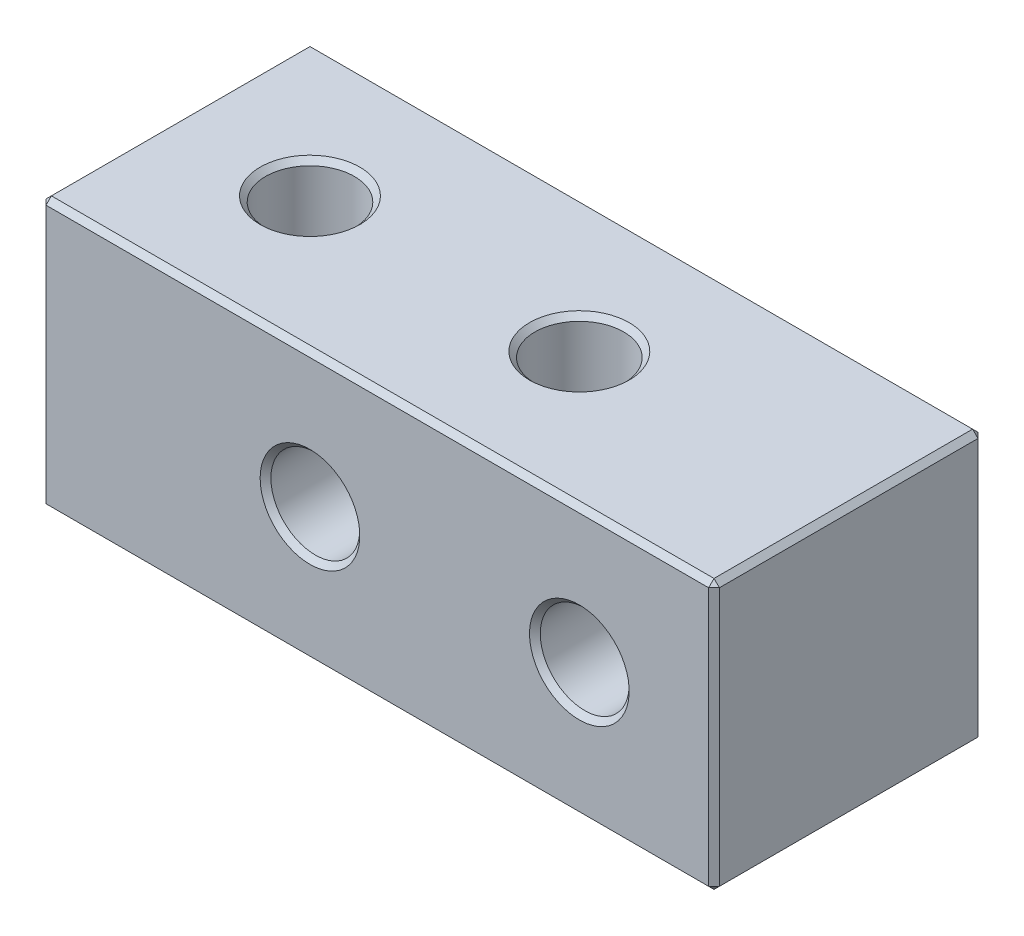
from build123d import *

# Parameters (mm, degrees)
SKETCH_1_W         = 25
SKETCH_1_H         = 10
EXTRUDE_1_DEPTH    = 5
HOLE_WIZARD_M4_1_D = 3.3
HOLE_WIZARD_M4_2_D = 3.3
CHAMFER_1_SIZE     = 0.2


with BuildPart() as part:
    # 草图1 → 凸台-拉伸1 (new, symmetric)
    with BuildSketch(Plane(origin=(0, 0, 0), x_dir=(1, 0, 0), z_dir=(0, 1, 0))):
        Rectangle(SKETCH_1_W, SKETCH_1_H)
    extrude(amount=EXTRUDE_1_DEPTH, both=True)

    # M4 螺纹孔1 (through all)
    with Locations(Plane(origin=(0, 5, 0), x_dir=(1, 0, 0), z_dir=(0, 1, 0))):
        with Locations((-7.5, 0), (2.5, 0)):
            Hole(HOLE_WIZARD_M4_1_D / 2)

    # M4 螺纹孔2 (through all)
    with Locations(Plane(origin=(0, 0, -5), x_dir=(-1, 0, 0), z_dir=(0, 0, -1))):
        with Locations((-7.5, 0), (2.5, 0)):
            Hole(HOLE_WIZARD_M4_2_D / 2)

    # 倒角1
    chamfer_1_edges = [part.edges().sort_by_distance(p)[0] for p in [
        (-12.5, 5, 0),
        (4.15, 5, 0),
        (4.15, -5, 0),
        (0, 5, 5),
        (-5.85, 5, 0),
        (-5.85, -5, 0),
        (-4.15, 0, -5),
        (-4.15, 0, 5),
        (5.85, 0, -5),
        (5.85, 0, 5),
        (12.5, 5, 0),
        (0, -5, 5),
        (-12.5, -5, 0),
        (0, -5, -5),
        (12.5, -5, 0),
        (12.5, 0, 5),
        (-12.5, 0, 5),
        (-12.5, 0, -5),
        (12.5, 0, -5),
        (0, 5, -5),
    ]]
    chamfer(chamfer_1_edges, length=CHAMFER_1_SIZE)


solid = part.part
